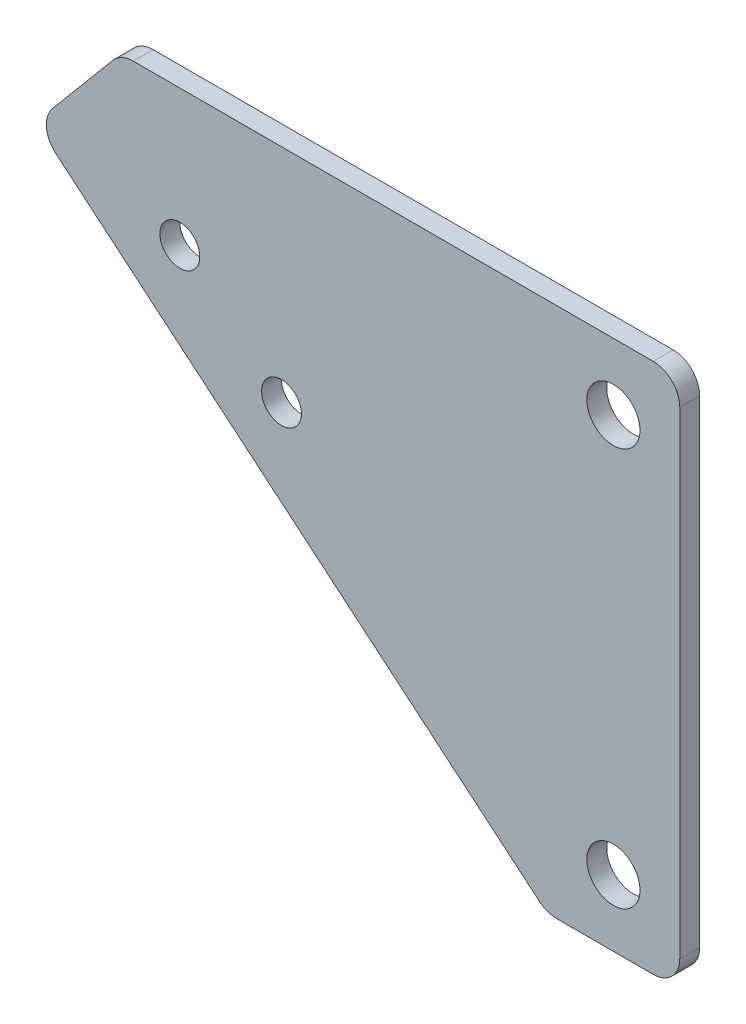
from build123d import *

# Parameters (mm, degrees)
SKETCH_1_R      = 1.5
SKETCH_1_R_2    = 2
EXTRUDE_1_DEPTH = 1.5
FILLET_1_R      = 2


with BuildPart() as part:
    # ｽｹｯﾁ1 → ﾎﾞｽ - 押し出し1 (new body)
    with BuildSketch(Plane.XY):
        Polygon((0, 0), (-10, 0), (-48.540781532, 32.339555569), (-42.112905435, 40), (0, 40), align=None)
        with Locations((-37.666399052, 29.741901688)):
            Circle(SKETCH_1_R, mode=Mode.SUBTRACT)
        with Locations((-30.005954621, 23.314025591)):
            Circle(SKETCH_1_R, mode=Mode.SUBTRACT)
        with Locations((-5, 5)):
            Circle(SKETCH_1_R_2, mode=Mode.SUBTRACT)
        with Locations((-5, 35)):
            Circle(SKETCH_1_R_2, mode=Mode.SUBTRACT)
    extrude(amount=EXTRUDE_1_DEPTH)

    # ﾌｨﾚｯﾄ1
    fillet_1_edges = [part.edges().sort_by_distance(p)[0] for p in [
        (0, 0, 0.75),
        (-10, 0, 0.75),
        (-48.540781532, 32.339555569, 0.75),
        (-42.112905435, 40, 0.75),
        (0, 40, 0.75),
    ]]
    fillet(fillet_1_edges, radius=FILLET_1_R)


solid = part.part
